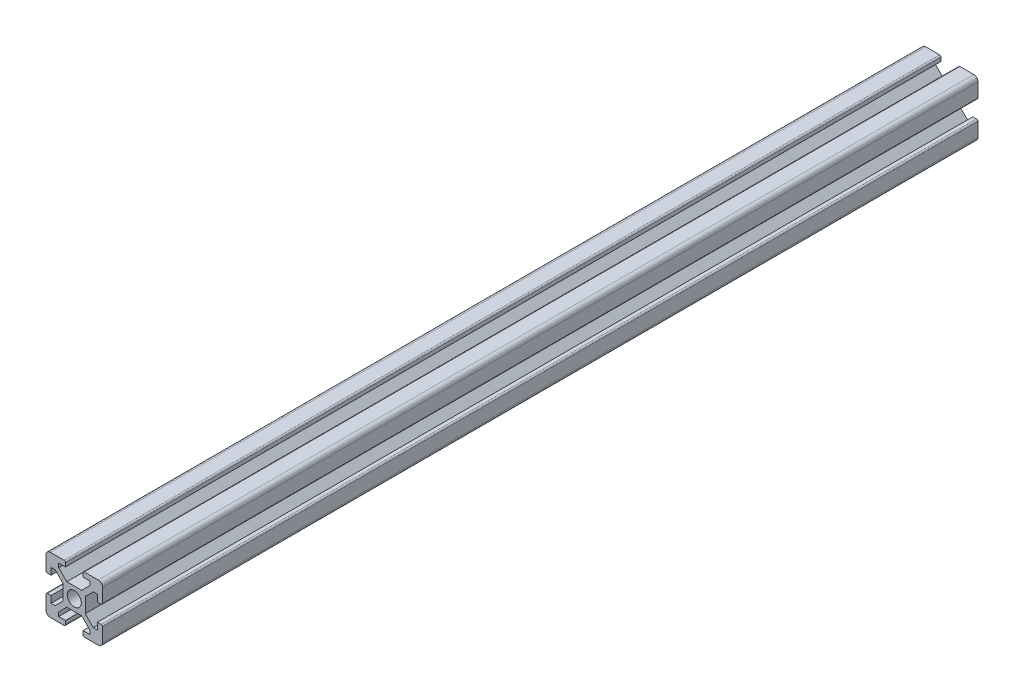
from build123d import *

# Parameters (mm, degrees)
SKETCH_1_R      = 2.5
EXTRUDE_1_DEPTH = 310
FILLET_1_R      = 1.5
FILLET_2_R      = 1.5
FILLET_3_R      = 1.5
FILLET_4_R      = 1.5
FILLET_5_R      = 0.5
FILLET_6_R      = 0.5
FILLET_7_R      = 0.5
FILLET_8_R      = 0.5
FILLET_9_R      = 0.5
FILLET_10_R     = 0.5
FILLET_11_R     = 0.5
FILLET_12_R     = 0.5


with BuildPart() as part:
    # 草图1 → 凸台-拉伸1 (new body)
    with BuildSketch(Plane.XY):
        Polygon((0, 6.9), (0, 0), (6.9, 0), (6.9, 1.8), (4.5, 1.8), (4.5, 3.227207794), (7.372792206, 6.1), (12.627207794, 6.1), (15.5, 3.227207794), (15.5, 1.8), (13.1, 1.8), (13.1, 0), (20, 0), (20, 6.9), (18.2, 6.9), (18.2, 4.5), (16.772792206, 4.5), (13.9, 7.372792206), (13.9, 12.627207794), (16.772792206, 15.5), (18.2, 15.5), (18.2, 13.1), (20, 13.1), (20, 20), (13.1, 20), (13.1, 18.2), (15.5, 18.2), (15.5, 16.772792206), (12.627207794, 13.9), (7.372792206, 13.9), (4.5, 16.772792206), (4.5, 18.2), (6.9, 18.2), (6.9, 20), (0, 20), (0, 13.1), (1.8, 13.1), (1.8, 15.5), (3.227207794, 15.5), (6.1, 12.627207794), (6.1, 7.372792206), (3.227207794, 4.5), (1.8, 4.5), (1.8, 6.9), align=None)
        with Locations((10, 10)):
            Circle(SKETCH_1_R, mode=Mode.SUBTRACT)
    extrude(amount=EXTRUDE_1_DEPTH)

    # 圆角1
    fillet_1_edges = [part.edges().sort_by_distance(p)[0] for p in [
        (20, 20, 155),
    ]]
    fillet(fillet_1_edges, radius=FILLET_1_R)

    # 圆角2
    fillet_2_edges = [part.edges().sort_by_distance(p)[0] for p in [
        (0, 20, 155),
    ]]
    fillet(fillet_2_edges, radius=FILLET_2_R)

    # 圆角3
    fillet_3_edges = [part.edges().sort_by_distance(p)[0] for p in [
        (0, 0, 155),
    ]]
    fillet(fillet_3_edges, radius=FILLET_3_R)

    # 圆角4
    fillet_4_edges = [part.edges().sort_by_distance(p)[0] for p in [
        (20, 0, 155),
    ]]
    fillet(fillet_4_edges, radius=FILLET_4_R)

    # 圆角5
    fillet_5_edges = [part.edges().sort_by_distance(p)[0] for p in [
        (13.1, 20, 155),
    ]]
    fillet(fillet_5_edges, radius=FILLET_5_R)

    # 圆角6
    fillet_6_edges = [part.edges().sort_by_distance(p)[0] for p in [
        (6.9, 20, 155),
    ]]
    fillet(fillet_6_edges, radius=FILLET_6_R)

    # 圆角7
    fillet_7_edges = [part.edges().sort_by_distance(p)[0] for p in [
        (0, 13.1, 155),
    ]]
    fillet(fillet_7_edges, radius=FILLET_7_R)

    # 圆角8
    fillet_8_edges = [part.edges().sort_by_distance(p)[0] for p in [
        (0, 6.9, 155),
    ]]
    fillet(fillet_8_edges, radius=FILLET_8_R)

    # 圆角9
    fillet_9_edges = [part.edges().sort_by_distance(p)[0] for p in [
        (6.9, 0, 155),
    ]]
    fillet(fillet_9_edges, radius=FILLET_9_R)

    # 圆角10
    fillet_10_edges = [part.edges().sort_by_distance(p)[0] for p in [
        (13.1, 0, 155),
    ]]
    fillet(fillet_10_edges, radius=FILLET_10_R)

    # 圆角11
    fillet_11_edges = [part.edges().sort_by_distance(p)[0] for p in [
        (20, 13.1, 155),
    ]]
    fillet(fillet_11_edges, radius=FILLET_11_R)

    # 圆角12
    fillet_12_edges = [part.edges().sort_by_distance(p)[0] for p in [
        (20, 6.9, 155),
    ]]
    fillet(fillet_12_edges, radius=FILLET_12_R)


solid = part.part
